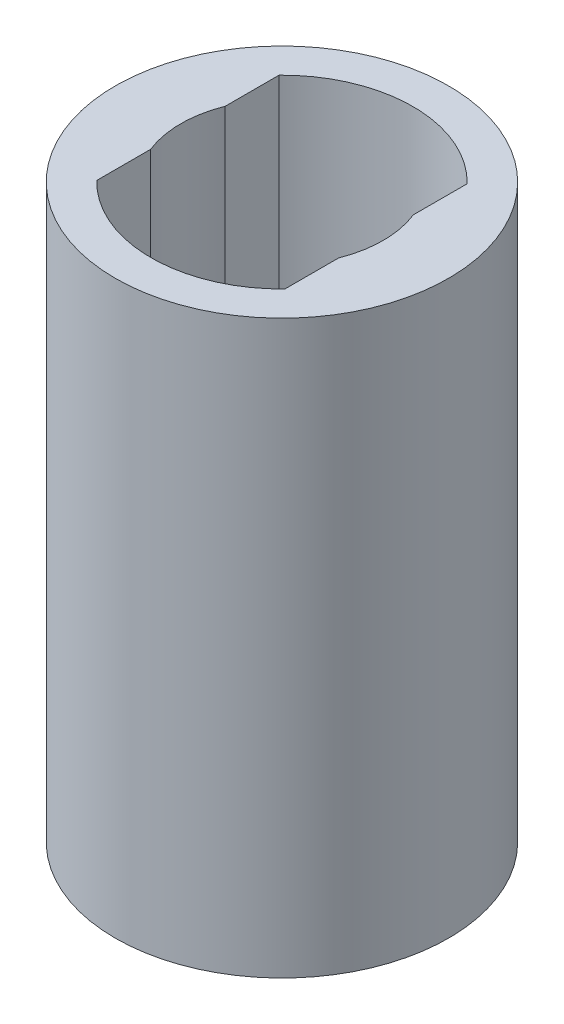
from build123d import *

# Parameters (mm, degrees)
SKETCH_1_R          = 3.5
EXTRUDE_1_DEPTH     = 12
SKETCH_2_R          = 2.125
CUT_EXTRUDE_1_DEPTH = 12
SKETCH_3_R          = 1.5
CUT_EXTRUDE_2_DEPTH = 12
CUT_EXTRUDE_3_DEPTH = 5


with BuildPart() as part:
    # 草图1 → 凸台-拉伸1 (new body)
    with BuildSketch(Plane(origin=(0, 0, 0), x_dir=(1, 0, 0), z_dir=(0, 1, 0))):
        with Locations(Location((0, 0, 0), (0, 0, 270))):
            Circle(SKETCH_1_R)
    extrude(amount=EXTRUDE_1_DEPTH)

    # 草图2 → 切除-拉伸1 (cut)
    with BuildSketch(Plane(origin=(0, 12, 0), x_dir=(1, 0, 0), z_dir=(0, 1, 0))):
        with Locations(Location((0, 0, 0), (0, 0, 270))):
            Circle(SKETCH_2_R)
    extrude(amount=-CUT_EXTRUDE_1_DEPTH, mode=Mode.SUBTRACT)

    # 草图3 → 切除-拉伸2 (cut)
    with BuildSketch(Plane(origin=(0, 0, 0), x_dir=(0, 0, -1), z_dir=(1, 0, 0))):
        with Locations((0, 2.692201217)):
            Circle(SKETCH_3_R)
    extrude(amount=-CUT_EXTRUDE_2_DEPTH, mode=Mode.SUBTRACT)

    # 草图4 → 切除-拉伸3 (cut)
    with BuildSketch(Plane(origin=(0, 12, 0), x_dir=(1, 0, 0), z_dir=(0, 1, 0))):
        with BuildLine():
            Line((-1.975, 1.913602623), (-1.975, -1.913602623))
            ThreePointArc((-1.975, -1.913602623), (0, -2.75), (1.975, -1.913602623))
            Line((1.975, -1.913602623), (1.975, 1.913602623))
            ThreePointArc((1.975, 1.913602623), (0, 2.75), (-1.975, 1.913602623))
        make_face()
    extrude(amount=-CUT_EXTRUDE_3_DEPTH, mode=Mode.SUBTRACT)


solid = part.part
